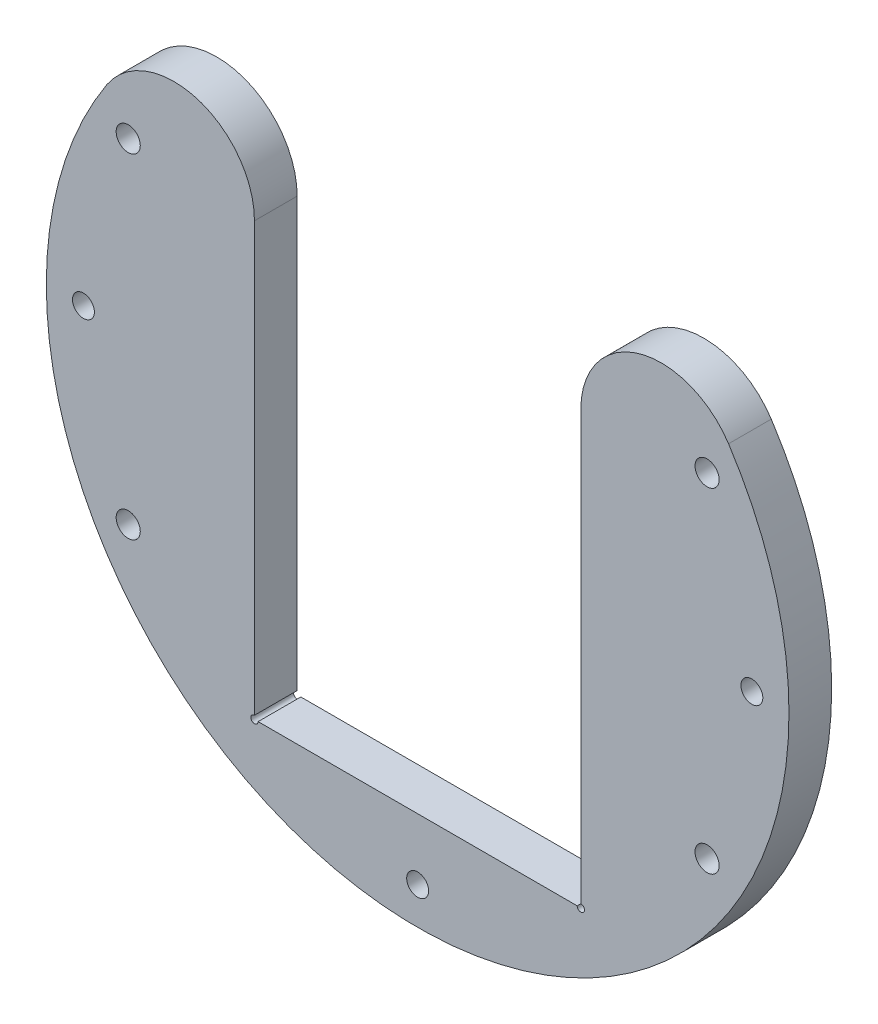
from build123d import *

# Parameters (mm, degrees)
SKETCH1_R           = 1.5
SKETCH1_R_2         = 1.65
BOSS_EXTRUDE1_DEPTH = 5.842
FILLET2_R           = 11
SKETCH2_R           = 0.5
CUT_EXTRUDE1_DEPTH  = 73.079185373


with BuildPart() as part:
    # Sketch1 → Boss-Extrude1 (new body)
    with BuildSketch(Plane.XY):
        with BuildLine():
            Line((22.325000054, -37.323), (22.325000054, 28.495993037))
            Line((22.325000054, 28.495993037), (22.325000054, 45.631506359))
            ThreePointArc((22.325000054, 45.631506359), (0, -50.8), (-22.325000054, 45.631506359))
            Line((-22.325000054, 45.631506359), (-22.325000054, 28.495993037))
            Line((-22.325000054, 28.495993037), (-22.325000054, -37.323))
            Line((-22.325000054, -37.323), (22.325000054, -37.323))
        make_face()
        with Locations((-45.72, 0)):
            Circle(SKETCH1_R, mode=Mode.SUBTRACT)
        with Locations((45.72, 0)):
            Circle(SKETCH1_R, mode=Mode.SUBTRACT)
        with Locations((0, -45.72)):
            Circle(SKETCH1_R, mode=Mode.SUBTRACT)
        with Locations((39.594681461, 22.86)):
            Circle(SKETCH1_R_2, mode=Mode.SUBTRACT)
        with Locations((39.594681461, -22.86)):
            Circle(SKETCH1_R_2, mode=Mode.SUBTRACT)
        with Locations((-39.594681461, -22.86)):
            Circle(SKETCH1_R_2, mode=Mode.SUBTRACT)
        with Locations((-39.594681461, 22.86)):
            Circle(SKETCH1_R_2, mode=Mode.SUBTRACT)
    extrude(amount=BOSS_EXTRUDE1_DEPTH)

    # Fillet2
    fillet2_edges = [part.edges().sort_by_distance(p)[0] for p in [
        (22.325000054, 45.631506359, 2.921),
        (-22.325000054, 45.631506359, 2.921),
    ]]
    fillet(fillet2_edges, radius=FILLET2_R)

    # Sketch2 → Cut-Extrude1 (cut, through all)
    with BuildSketch(Plane.XY.offset(5.842)):
        with Locations((-22.325000054, -37.323)):
            Circle(SKETCH2_R)
        with Locations((22.325000054, -37.323)):
            Circle(SKETCH2_R)
    extrude(amount=-CUT_EXTRUDE1_DEPTH, mode=Mode.SUBTRACT)


solid = part.part
